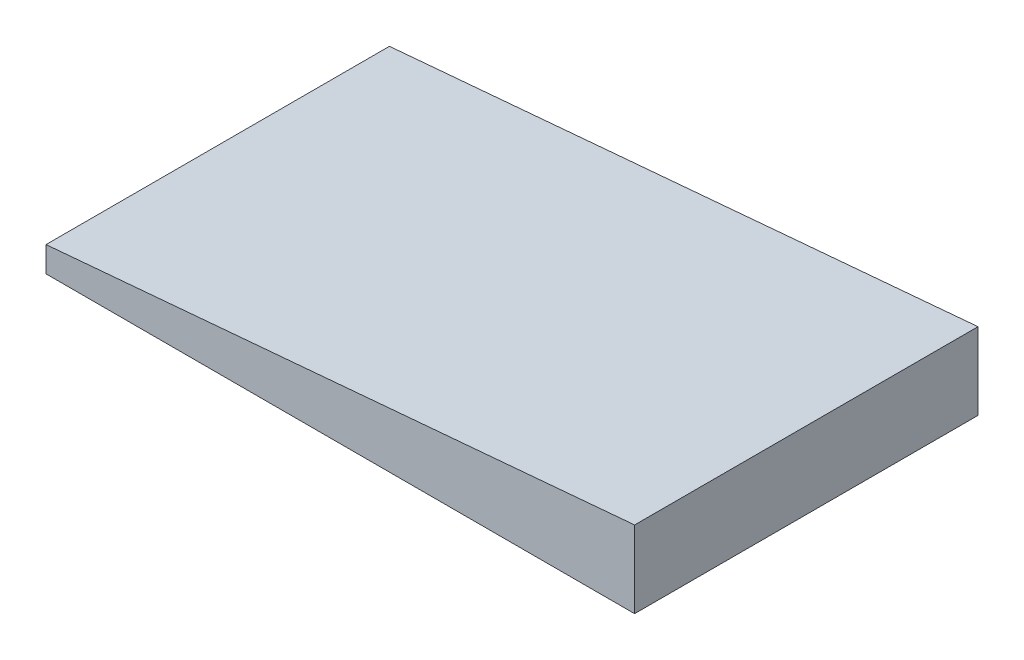
from build123d import *

# Parameters (mm, degrees)
SALIENTE_EXTRUIR1_DEPTH = 338.5
VACIADO1_T              = -20
SALIENTE_EXTRUIR2_DEPTH = 10
MATRIZL1_COUNT          = 2
MATRIZL1_PITCH          = 170
MATRIZL2_COUNT          = 2
MATRIZL2_PITCH          = 170


with BuildPart() as part:
    # Croquis1 → Saliente-Extruir1 (new, symmetric)
    with BuildSketch(Plane.XY):
        Polygon((0, 0), (0, 50), (1160.4, 151.521845155), (1160.4, 0), align=None)
    extrude(amount=SALIENTE_EXTRUIR1_DEPTH, both=True)

    # Vaciado1
    vaciado1_openings = [part.faces().sort_by_distance(p)[0] for p in [
        (580.2, 0, 0),
    ]]
    offset(amount=VACIADO1_T, openings=vaciado1_openings, kind=Kind.INTERSECTION)

    # Croquis2 → Saliente-Extruir2 (add, symmetric)
    with BuildSketch(Plane.XY):
        Polygon((20, 31.67337652), (20, 0), (1140.4, 0), (1140.4, 129.695675134), align=None)
    saliente_extruir2 = extrude(amount=SALIENTE_EXTRUIR2_DEPTH, both=True)

    # MatrizL1: Saliente-Extruir2 ×2
    with Locations(*[(0, 0, i * MATRIZL1_PITCH) for i in range(1, MATRIZL1_COUNT)]):
        add(saliente_extruir2)

    # MatrizL2: Saliente-Extruir2 ×2
    with Locations(*[(0, 0, -i * MATRIZL2_PITCH) for i in range(1, MATRIZL2_COUNT)]):
        add(saliente_extruir2)


solid = part.part
